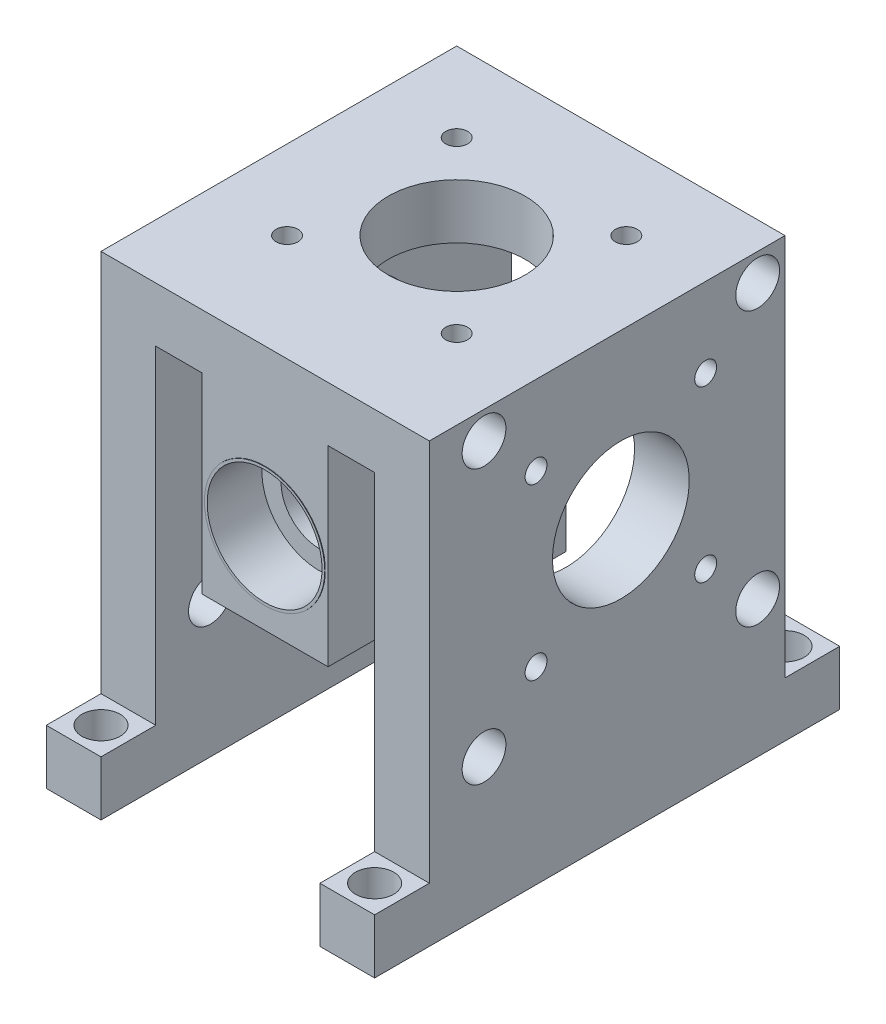
from build123d import *

# Parameters (mm, degrees)
CROQUIS1_W              = 60
CROQUIS1_H              = 65
SALIENTE_EXTRUIR1_DEPTH = 80
CROQUIS2_R              = 12.5
CROQUIS2_R_2            = 2
CROQUIS2_R_3            = 4
CORTAR_EXTRUIR1_DEPTH   = 120.268604419
CROQUIS3_W              = 38
CROQUIS3_H              = 70
CORTAR_EXTRUIR4_DEPTH   = 50
CROQUIS4_W              = 8.5
CROQUIS4_H              = 70
CORTAR_EXTRUIR5_DEPTH   = 120.268604419
CROQUIS6_R              = 12.5
CROQUIS6_R_2            = 2
CORTAR_EXTRUIR6_DEPTH   = 120.268604419
CROQUIS15_R             = 11
SALIENTE_EXTRUIR6_DEPTH = 0.1
CROQUIS16_R             = 10.5
CORTAR_EXTRUIR11_DEPTH  = 10
CORTAR_EXTRUIR12_REACH  = 116.175
CROQUIS17_R             = 7
CROQUIS10_W             = 23
CROQUIS10_H             = 35
CORTAR_EXTRUIR9_DEPTH   = 120.268604419
CROQUIS11_W             = 10
CROQUIS11_H             = 10
SALIENTE_EXTRUIR4_DEPTH = 10
SKETCH1_R               = 3.5
CUT_EXTRUDE1_DEPTH      = 113.805141727


with BuildPart() as part:
    # Croquis1 → Saliente-Extruir1 (new body)
    with BuildSketch(Plane(origin=(0, 0, 0), x_dir=(1, 0, 0), z_dir=(0, 1, 0))):
        with Locations((30, 32.5)):
            Rectangle(CROQUIS1_W, CROQUIS1_H)
    extrude(amount=SALIENTE_EXTRUIR1_DEPTH)

    # Croquis2 → Cortar-Extruir1 (cut, through all)
    with BuildSketch(Plane.ZY):
        with Locations((-35, 50)):
            Circle(CROQUIS2_R)
        with Locations((-50.5, 65.5)):
            Circle(CROQUIS2_R_2)
        with Locations((-19.5, 65.5)):
            Circle(CROQUIS2_R_2)
        with Locations((-19.5, 34.5)):
            Circle(CROQUIS2_R_2)
        with Locations((-50.5, 34.5)):
            Circle(CROQUIS2_R_2)
        with Locations((-60, 75)):
            Circle(CROQUIS2_R_3)
        with Locations((-10, 75)):
            Circle(CROQUIS2_R_3)
        with Locations((-10, 25)):
            Circle(CROQUIS2_R_3)
        with Locations((-60, 25)):
            Circle(CROQUIS2_R_3)
    extrude(amount=-CORTAR_EXTRUIR1_DEPTH, mode=Mode.SUBTRACT)

    # Croquis3 → Cortar-Extruir4 (cut)
    with BuildSketch(Plane(origin=(0, 0, -65), x_dir=(-1, 0, 0), z_dir=(0, 0, -1))):
        with Locations((-30, 35)):
            Rectangle(CROQUIS3_W, CROQUIS3_H)
    extrude(amount=-CORTAR_EXTRUIR4_DEPTH, mode=Mode.SUBTRACT)

    # Croquis4 → Cortar-Extruir5 (cut, through all)
    with BuildSketch(Plane.XY):
        with Locations((14.25, 35)):
            Rectangle(CROQUIS4_W, CROQUIS4_H)
        with Locations((45.75, 35)):
            Rectangle(CROQUIS4_W, CROQUIS4_H)
    extrude(amount=-CORTAR_EXTRUIR5_DEPTH, mode=Mode.SUBTRACT)

    # Croquis6 → Cortar-Extruir6 (cut, through all)
    with BuildSketch(Plane(origin=(0, 80, 0), x_dir=(1, 0, 0), z_dir=(0, 1, 0))):
        with Locations(Location((30, 35, 0), (0, 0, 270))):
            Circle(CROQUIS6_R)
        with Locations(Location((14.5, 50.5, 0), (0, 0, 270))):
            Circle(CROQUIS6_R_2)
        with Locations(Location((45.5, 50.5, 0), (0, 0, 270))):
            Circle(CROQUIS6_R_2)
        with Locations(Location((45.5, 19.5, 0), (0, 0, 270))):
            Circle(CROQUIS6_R_2)
        with Locations(Location((14.5, 19.5, 0), (0, 0, 270))):
            Circle(CROQUIS6_R_2)
    extrude(amount=-CORTAR_EXTRUIR6_DEPTH, mode=Mode.SUBTRACT)

    # Croquis15 → Saliente-Extruir6 (add)
    with BuildSketch(Plane.XY):
        with Locations(Location((30, 50, 0), (0, 0, 180))):
            Circle(CROQUIS15_R)
    extrude(amount=SALIENTE_EXTRUIR6_DEPTH)

    # Croquis16 → Cortar-Extruir11 (cut)
    with BuildSketch(Plane.XY.offset(0.1)):
        with Locations((30, 50)):
            Circle(CROQUIS16_R)
    extrude(amount=-CORTAR_EXTRUIR11_DEPTH, mode=Mode.SUBTRACT)

    # Croquis17 → Cortar-Extruir12 (cut, up to next)
    with BuildSketch(Plane.XY.offset(-9.9), mode=Mode.PRIVATE) as cortar_extruir12_sk1:
        with Locations((30, 50)):
            Circle(CROQUIS17_R)
    cortar_extruir12_tool1 = extrude(cortar_extruir12_sk1.sketch, amount=-CORTAR_EXTRUIR12_REACH, mode=Mode.PRIVATE) & part.part
    add(cortar_extruir12_tool1.solids().sort_by_distance((30, 50, -9.9))[0], mode=Mode.SUBTRACT)

    # Croquis10 → Cortar-Extruir9 (cut, through all)
    with BuildSketch(Plane.XY):
        with Locations((30, 17.5)):
            Rectangle(CROQUIS10_W, CROQUIS10_H)
    extrude(amount=-CORTAR_EXTRUIR9_DEPTH, mode=Mode.SUBTRACT)

    # Croquis11 → Saliente-Extruir4 (add)
    with BuildSketch(Plane.XY):
        with Locations((5, 5)):
            Rectangle(CROQUIS11_W, CROQUIS11_H)
        with Locations((55, 5)):
            Rectangle(CROQUIS11_W, CROQUIS11_H)
    saliente_extruir4 = extrude(amount=SALIENTE_EXTRUIR4_DEPTH)

    # Sketch1 → Cut-Extrude1 (cut, through all)
    with BuildSketch(Plane(origin=(0, 10, 0), x_dir=(1, 0, 0), z_dir=(0, 1, 0))):
        with Locations(Location((5, -5, 0), (0, 0, 270))):
            Circle(SKETCH1_R)
        with Locations(Location((55, -5, 0), (0, 0, 270))):
            Circle(SKETCH1_R)
    cut_extrude1 = extrude(amount=-CUT_EXTRUDE1_DEPTH, mode=Mode.SUBTRACT)

    # Mirror2: Saliente-Extruir4, Cut-Extrude1 across plane
    add(saliente_extruir4.mirror(Plane.XY.offset(-32.5)))
    add(cut_extrude1.mirror(Plane.XY.offset(-32.5)), mode=Mode.SUBTRACT)


solid = part.part
